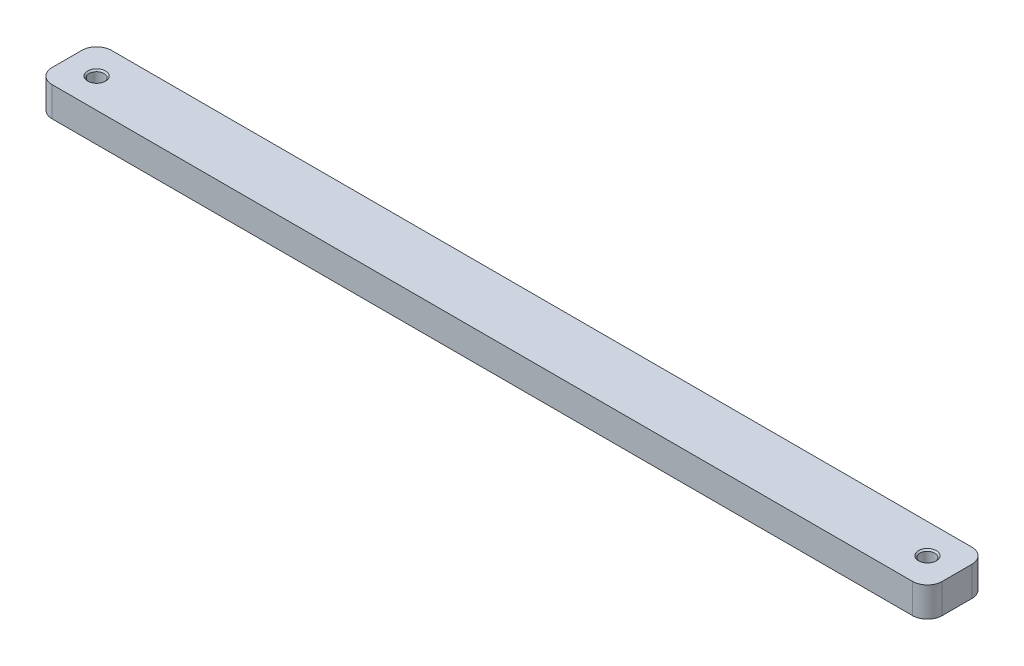
from build123d import *

# Parameters (mm, degrees)
SCHIZZO1_W                      = 300
SCHIZZO1_H                      = 20
ESTRUSIONE_ESTRUSIONE1_DEPTH    = 10
FORO_FILETTATO_M6_5_D           = 5
FORO_FILETTATO_M6_5_CSINK_D     = 6
FORO_FILETTATO_M6_5_CSINK_ANGLE = 90
RACCORDO1_R                     = 5


with BuildPart() as part:
    # Schizzo1 → Estrusione-Estrusione1 (new body)
    with BuildSketch(Plane(origin=(0, 0, 0), x_dir=(1, 0, 0), z_dir=(0, 1, 0))):
        Rectangle(SCHIZZO1_W, SCHIZZO1_H)
    extrude(amount=ESTRUSIONE_ESTRUSIONE1_DEPTH)

    # Foro filettato M6-5 (through all)
    with Locations(Plane(origin=(0, 10, 0), x_dir=(1, 0, 0), z_dir=(0, 1, 0))):
        with Locations((-140, 0), (140, 0)):
            CounterSinkHole(FORO_FILETTATO_M6_5_D / 2, FORO_FILETTATO_M6_5_CSINK_D / 2, counter_sink_angle=FORO_FILETTATO_M6_5_CSINK_ANGLE)

    # Raccordo1
    raccordo1_edges = [part.edges().sort_by_distance(p)[0] for p in [
        (150, 5, 10),
        (-150, 5, 10),
        (-150, 5, -10),
        (150, 5, -10),
    ]]
    fillet(raccordo1_edges, radius=RACCORDO1_R)


solid = part.part
